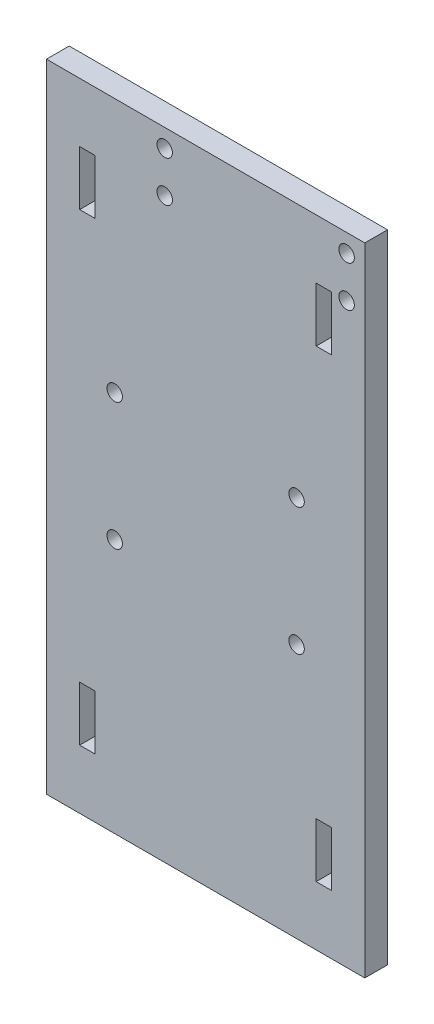
from build123d import *

# Parameters (mm, degrees)
SKETCH_1_W                                          = 70
SKETCH_1_H                                          = 140
BASE_70X140X5_DEPTH                                 = 5
CHASSIS_ADJUSTMENT_SLOTS_UNVERIFIED_POSI_DEPTH      = 79.421935707
CHASSIS_ADJUSTMENT_SLOTS_UNVERIFIED_POSI_DEPTH_BACK = 79.421935707
SKETCH_2_W                                          = 3.4
SKETCH_2_H                                          = 12
SUPPORT_AND_SERVO_MOUNT_M3_CLEARANCE_DEPTH          = 79.421935707
SUPPORT_AND_SERVO_MOUNT_M3_CLEARANCE_DEPTH_BACK     = 79.421935707
SKETCH_3_R                                          = 1.7


with BuildPart() as part:
    # 草图1 → Base_70x140x5 (new body)
    with BuildSketch(Plane.XY):
        Rectangle(SKETCH_1_W, SKETCH_1_H)
    extrude(amount=BASE_70X140X5_DEPTH)

    # 草图2 → Chassis_adjustment_slots_UNVERIFIED_positions (cut, two sides: drawn at the far end of the back side and taken through both)
    with BuildSketch(Plane.XY.offset(-CHASSIS_ADJUSTMENT_SLOTS_UNVERIFIED_POSI_DEPTH_BACK)):
        with Locations((-26, -51)):
            Rectangle(SKETCH_2_W, SKETCH_2_H)
        with Locations((-26, 51)):
            Rectangle(SKETCH_2_W, SKETCH_2_H)
        with Locations((26, -51)):
            Rectangle(SKETCH_2_W, SKETCH_2_H)
        with Locations((26, 51)):
            Rectangle(SKETCH_2_W, SKETCH_2_H)
    extrude(amount=CHASSIS_ADJUSTMENT_SLOTS_UNVERIFIED_POSI_DEPTH + CHASSIS_ADJUSTMENT_SLOTS_UNVERIFIED_POSI_DEPTH_BACK, mode=Mode.SUBTRACT)

    # 草图3 → Support_and_servo_mount_M3_clearance (cut, two sides: drawn at the far end of the back side and taken through both)
    with BuildSketch(Plane.XY.offset(-SUPPORT_AND_SERVO_MOUNT_M3_CLEARANCE_DEPTH_BACK)):
        with Locations((-20, -14)):
            Circle(SKETCH_3_R)
        with Locations((-20, 14)):
            Circle(SKETCH_3_R)
        with Locations((20, -14)):
            Circle(SKETCH_3_R)
        with Locations((20, 14)):
            Circle(SKETCH_3_R)
        with Locations((-9, 57)):
            Circle(SKETCH_3_R)
        with Locations((-9, 66)):
            Circle(SKETCH_3_R)
        with Locations((31, 57)):
            Circle(SKETCH_3_R)
        with Locations((31, 66)):
            Circle(SKETCH_3_R)
    extrude(amount=SUPPORT_AND_SERVO_MOUNT_M3_CLEARANCE_DEPTH + SUPPORT_AND_SERVO_MOUNT_M3_CLEARANCE_DEPTH_BACK, mode=Mode.SUBTRACT)


solid = part.part
